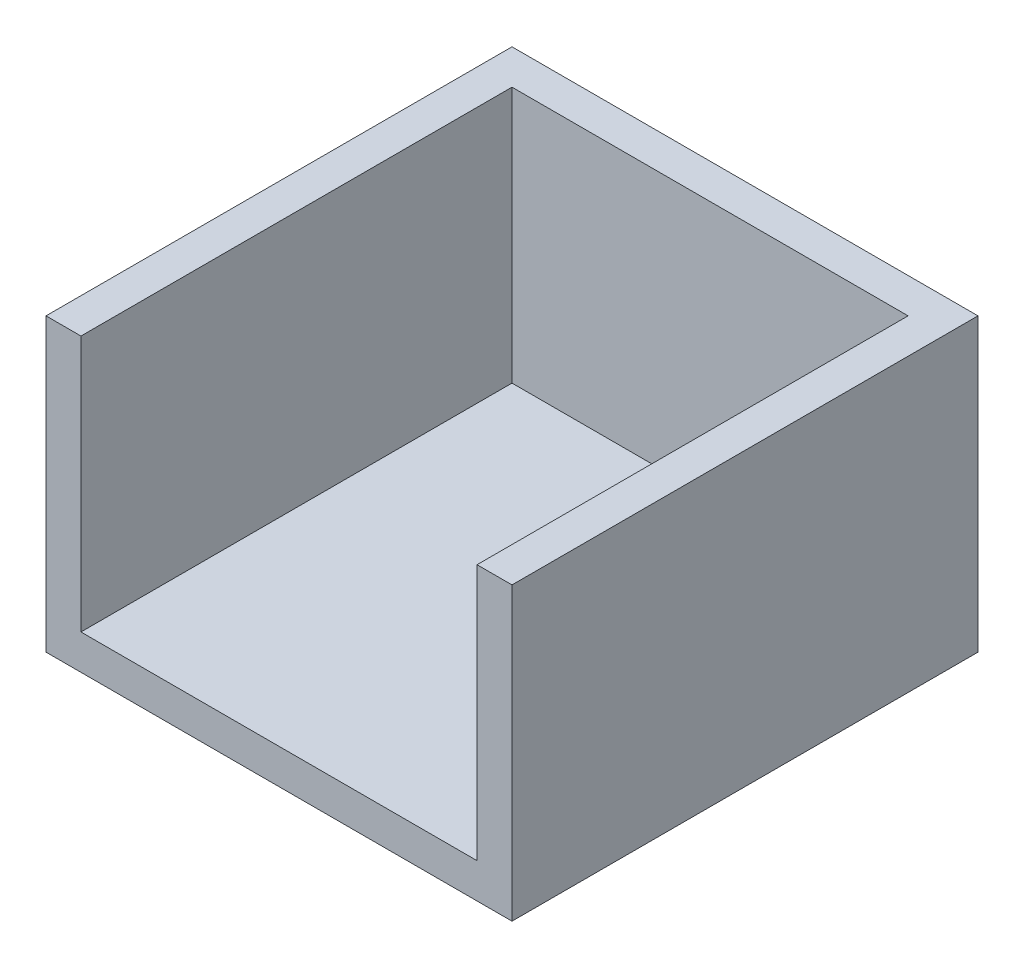
from build123d import *

# Parameters (mm, degrees)
SKETCH1_W           = 40
SKETCH1_H           = 40
BOSS_EXTRUDE1_DEPTH = 25
SKETCH2_W           = 34
SKETCH2_H           = 37
CUT_EXTRUDE1_DEPTH  = 22


with BuildPart() as part:
    # Sketch1 → Boss-Extrude1 (new body)
    with BuildSketch(Plane(origin=(0, 0, 0), x_dir=(1, 0, 0), z_dir=(0, 1, 0))):
        Rectangle(SKETCH1_W, SKETCH1_H)
    extrude(amount=BOSS_EXTRUDE1_DEPTH)

    # Sketch2 → Cut-Extrude1 (cut)
    with BuildSketch(Plane(origin=(0, 25, 0), x_dir=(1, 0, 0), z_dir=(0, 1, 0))):
        with Locations((0, -1.5)):
            Rectangle(SKETCH2_W, SKETCH2_H)
    extrude(amount=-CUT_EXTRUDE1_DEPTH, mode=Mode.SUBTRACT)


solid = part.part
